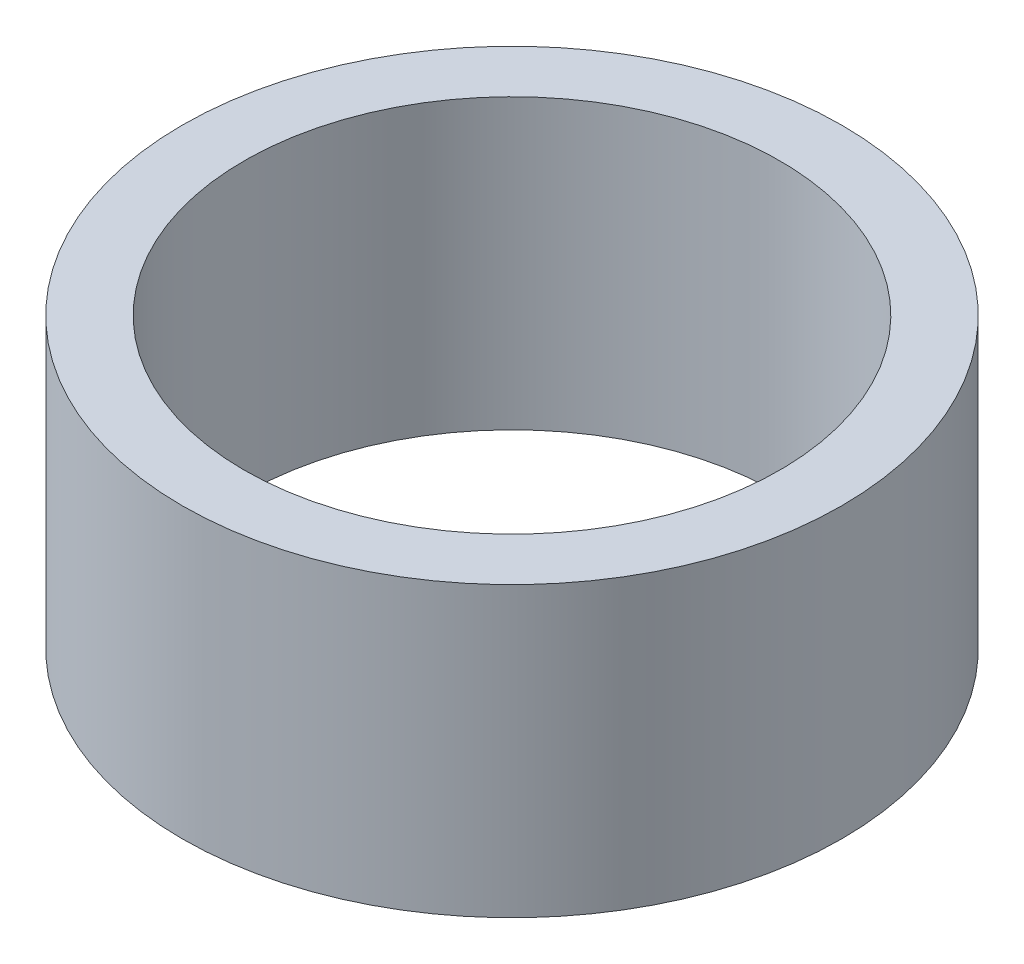
from build123d import *

# Parameters (mm, degrees)
IZIM1_R               = 16
IZIM1_R_2             = 13
EKSTR_ZYON_NCE1_DEPTH = 14


with BuildPart() as part:
    # Çizim1 → Ekstrüzyon-İnce1 (new body)
    with BuildSketch(Plane(origin=(0, 0, 0), x_dir=(1, 0, 0), z_dir=(0, 1, 0))):
        Circle(IZIM1_R)
        Circle(IZIM1_R_2, mode=Mode.SUBTRACT)
    extrude(amount=EKSTR_ZYON_NCE1_DEPTH)


solid = part.part
